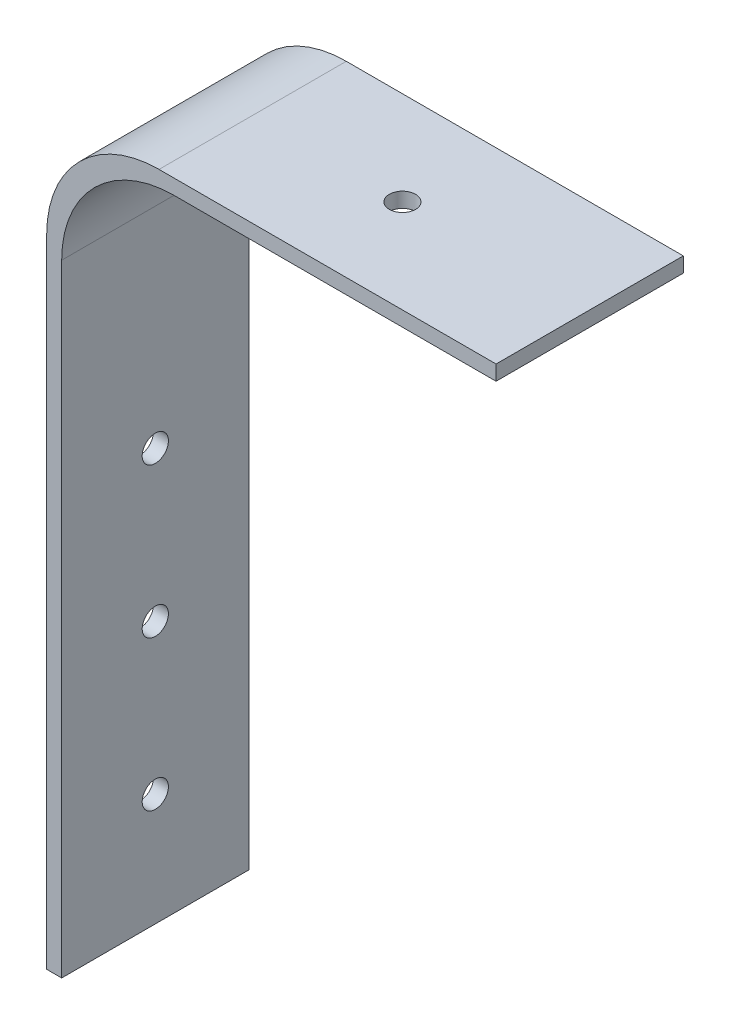
from build123d import *

# Parameters (mm, degrees)
BOSS_EXTRUDE1_DEPTH = 25
SKETCH2_R           = 1.75
CUT_EXTRUDE1_DEPTH  = 2
SKETCH3_R           = 1.75
CUT_EXTRUDE2_DEPTH  = 2


with BuildPart() as part:
    # Sketch1 → Boss-Extrude1 (new body)
    with BuildSketch(Plane.XY):
        with BuildLine():
            Line((-15, 30), (30, 30))
            Line((30, 30), (30, 28))
            Line((30, 28), (-13, 28))
            ThreePointArc((-13, 28), (-23.606601718, 23.606601718), (-28, 13))
            Line((-28, 13), (-28, -70))
            Line((-28, -70), (-30, -70))
            Line((-30, -70), (-30, 15))
            ThreePointArc((-30, 15), (-25.606601718, 25.606601718), (-15, 30))
        make_face()
    extrude(amount=BOSS_EXTRUDE1_DEPTH)

    # Sketch2 → Cut-Extrude1 (cut)
    with BuildSketch(Plane.ZY.offset(30)):
        with Locations(Location((12.5, -15, 0), (0, 0, 270))):
            Circle(SKETCH2_R)
        with Locations(Location((12.5, -35, 0), (0, 0, 270))):
            Circle(SKETCH2_R)
        with Locations(Location((12.5, -55, 0), (0, 0, 270))):
            Circle(SKETCH2_R)
    extrude(amount=-CUT_EXTRUDE1_DEPTH, mode=Mode.SUBTRACT)

    # Sketch3 → Cut-Extrude2 (cut)
    with BuildSketch(Plane(origin=(0, 30, 0), x_dir=(1, 0, 0), z_dir=(0, 1, 0))):
        with Locations(Location((5, -12.5, 0), (0, 0, 270))):
            Circle(SKETCH3_R)
    extrude(amount=-CUT_EXTRUDE2_DEPTH, mode=Mode.SUBTRACT)


solid = part.part
